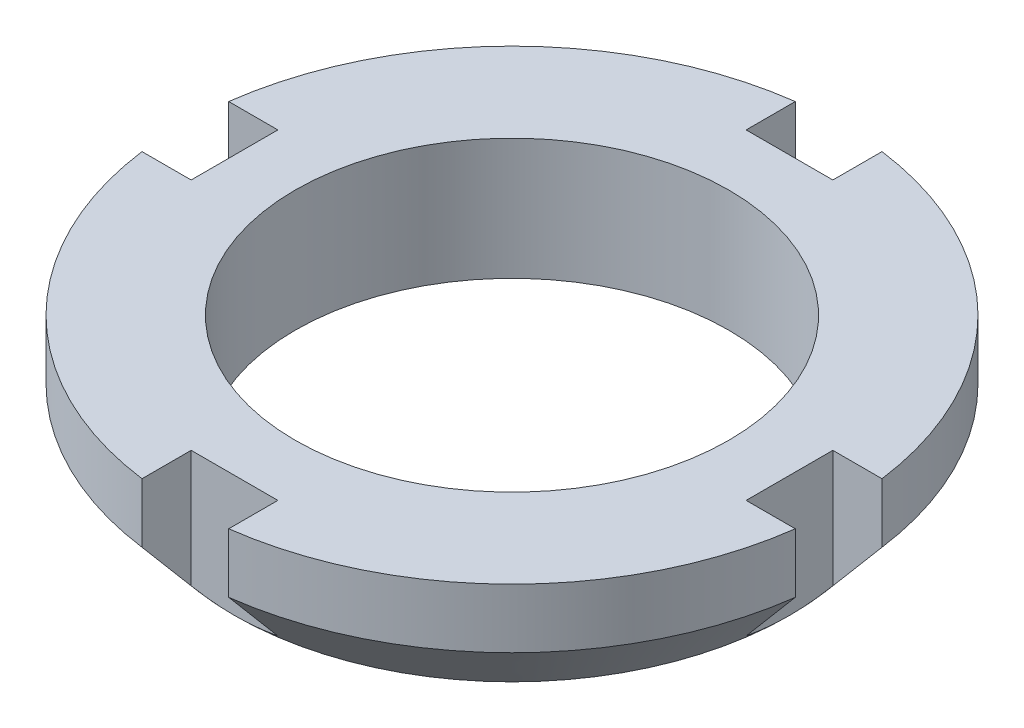
from build123d import *

# Parameters (mm, degrees)
NOTCH_DEPTH       = 28.766886754
CIRPATTERN1_COUNT = 4


with BuildPart() as part:
    # Profile → Nut (revolve)
    with BuildSketch(Plane.XY):
        Polygon((12.5, 7), (12.5, 0), (16, 0), (19, 3.575260778), (19, 7), align=None)
    revolve(axis=Axis((0, 25.4, 0), (0, -1, 0)))

    # Cut → Notch (cut, through all)
    with BuildSketch(Plane(origin=(0, 7, 0), x_dir=(-1, 0, 0), z_dir=(0, 1, 0))):
        with BuildLine():
            Line((2.5, -16), (-2.5, -16))
            Line((-2.5, -16), (-2.5, -18.834808202))
            ThreePointArc((-2.5, -18.834808202), (0, -19), (2.5, -18.834808202))
            Line((2.5, -18.834808202), (2.5, -16))
        make_face()
    notch = extrude(amount=-NOTCH_DEPTH, mode=Mode.SUBTRACT)

    # CirPattern1: Notch ×4 about axis
    cirpattern1_axis = Axis((0, -9.659760956, 0), (0, 1, 0))
    for i in range(1, CIRPATTERN1_COUNT):
        add(notch.rotate(cirpattern1_axis, i * 360 / CIRPATTERN1_COUNT), mode=Mode.SUBTRACT)


solid = part.part
